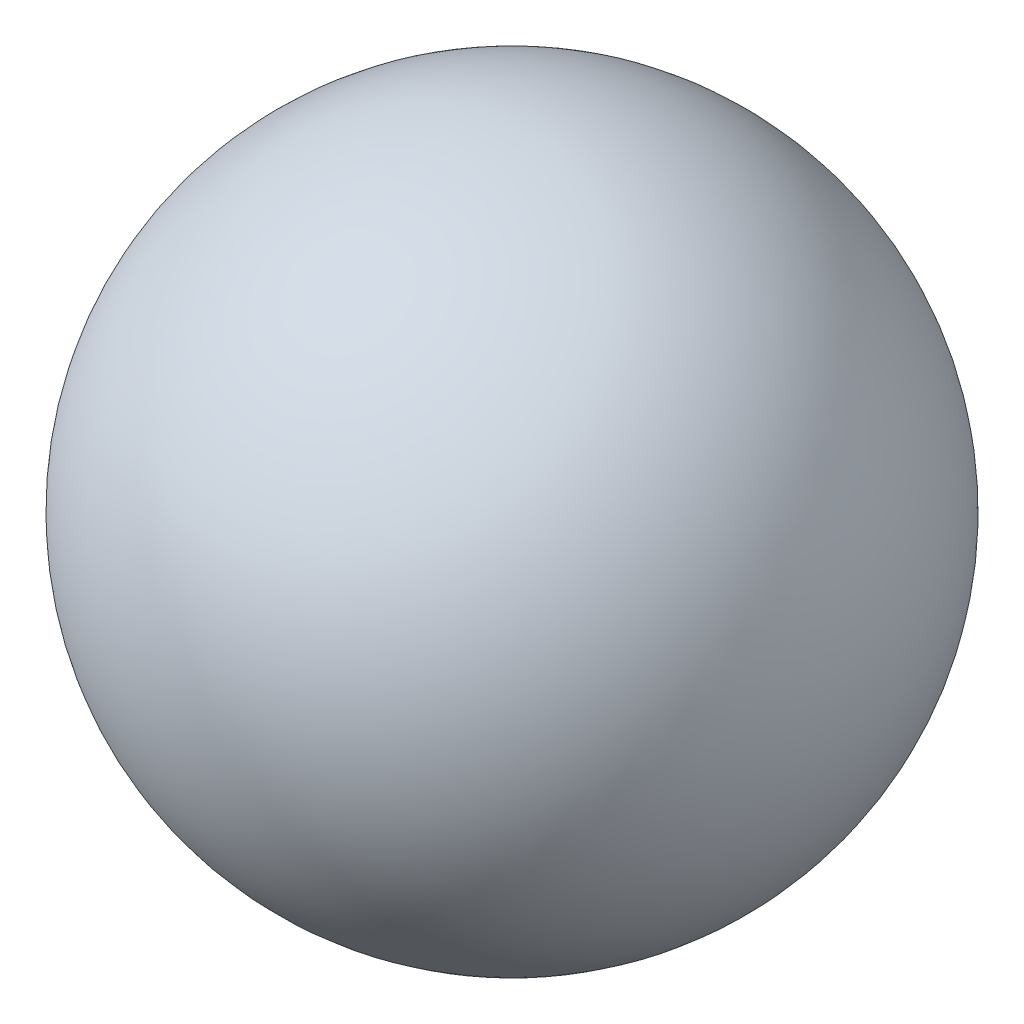
from build123d import *

# Parameters (mm, degrees)
SKETCH2_R          = 2
CUT_EXTRUDE1_DEPTH = 12.085125168


with BuildPart() as part:
    # Sketch1 → Revolve1 (revolve)
    with BuildSketch(Plane.XY):
        with BuildLine():
            Line((0, 6.4), (0, -6.4))
            ThreePointArc((0, -6.4), (6.4, 0), (0, 6.4))
        make_face()
    revolve(axis=Axis((0, 6.4, 0), (0, -1, 0)))

    # Sketch2 → Cut-Extrude1 (cut, through all)
    with BuildSketch(Plane(origin=(0, 0, 0), x_dir=(1, 0, 0), z_dir=(0, 1, 0))):
        with Locations(Location((0, 0, 0), (0, 0, 270))):
            Circle(SKETCH2_R)
    extrude(amount=-CUT_EXTRUDE1_DEPTH, mode=Mode.SUBTRACT)


solid = part.part
